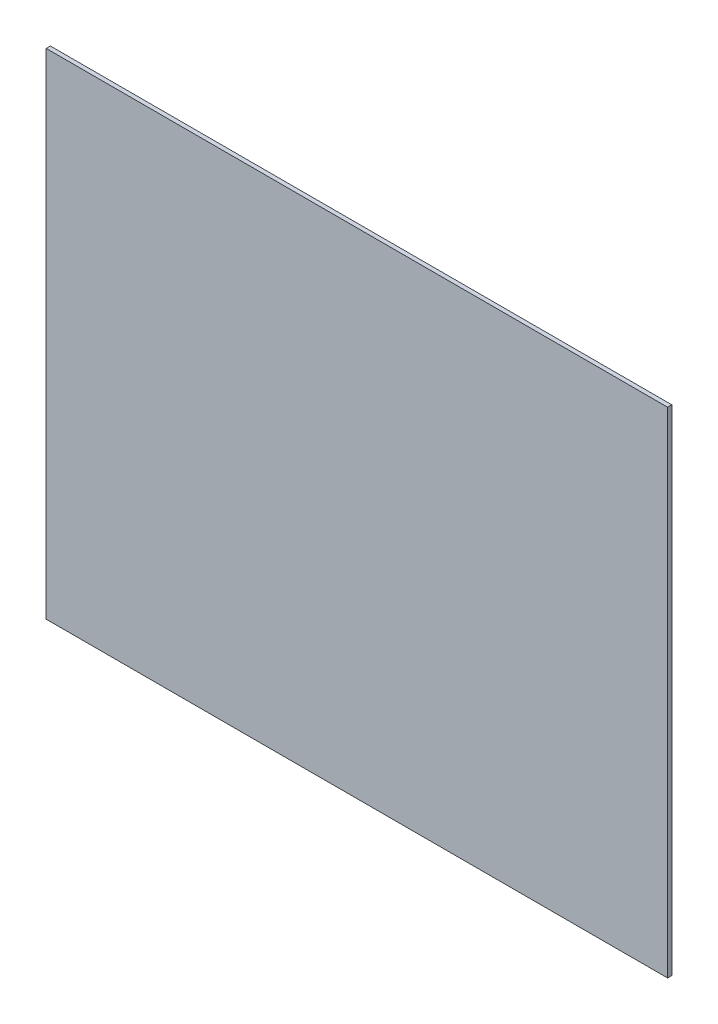
from build123d import *

# Parameters (mm, degrees)
SKETCH1_W           = 445
SKETCH1_H           = 354
BOSS_EXTRUDE1_DEPTH = 3


with BuildPart() as part:
    # Sketch1 → Boss-Extrude1 (new body)
    with BuildSketch(Plane.XY):
        with Locations((222.5, -73)):
            Rectangle(SKETCH1_W, SKETCH1_H)
    extrude(amount=BOSS_EXTRUDE1_DEPTH)


solid = part.part
